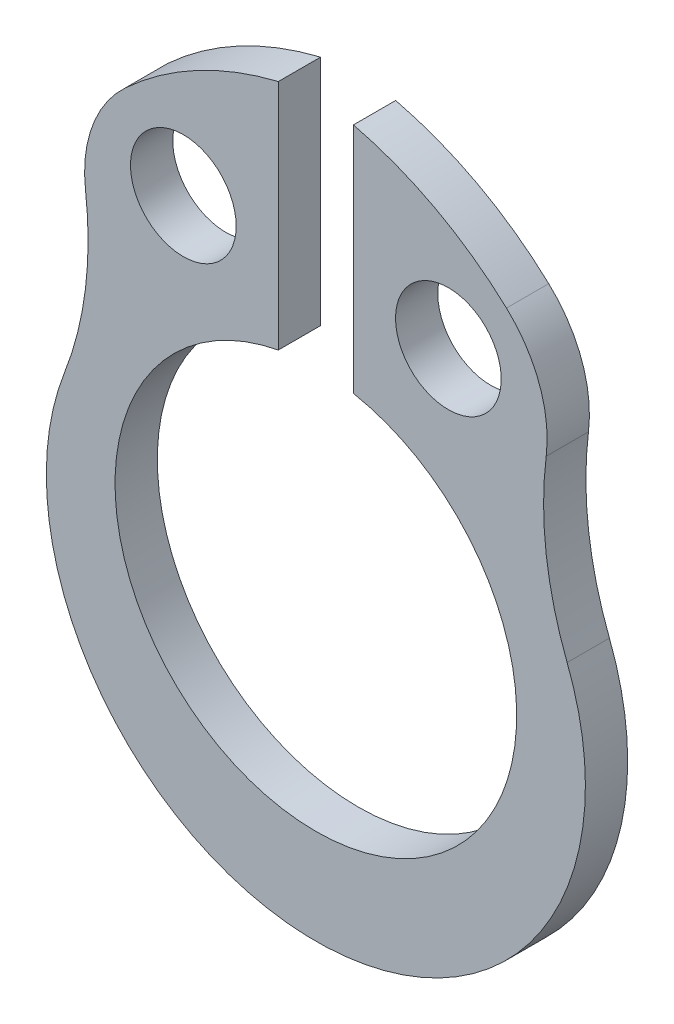
from build123d import *

# Parameters (mm, degrees)
SKETCH1_R           = 0.5
BOSS_EXTRUDE1_DEPTH = 0.2


with BuildPart() as part:
    # Sketch1 → Boss-Extrude1 (new, symmetric)
    with BuildSketch(Plane.XY):
        with BuildLine():
            Line((0.355177163, 4.066507215), (0.355177163, 1.866507215))
            ThreePointArc((0.355177163, 1.866507215), (0, -1.9), (-0.355177163, 1.866507215))
            Line((-0.355177163, 1.866507215), (-0.355177163, 4.066507215))
            ThreePointArc((-0.355177163, 4.066507215), (-1.128937663, 3.770726054), (-1.80338405, 3.289775039))
            ThreePointArc((-1.80338405, 3.289775039), (-2.114987451, 2.821889427), (-2.179084676, 2.263404717))
            ThreePointArc((-2.179084676, 2.263404717), (-2.179717367, 1.455750813), (-2.377239579, 0.67262234))
            ThreePointArc((-2.377239579, 0.67262234), (0, -2.8), (2.377239579, 0.67262234))
            ThreePointArc((2.377239579, 0.67262234), (2.179717367, 1.455750813), (2.179084676, 2.263404717))
            ThreePointArc((2.179084676, 2.263404717), (2.114987451, 2.821889427), (1.80338405, 3.289775039))
            ThreePointArc((1.80338405, 3.289775039), (1.128937663, 3.770726054), (0.355177163, 4.066507215))
        make_face()
        with Locations((-1.253673205, 2.682219999)):
            Circle(SKETCH1_R, mode=Mode.SUBTRACT)
        with Locations(Location((1.253673205, 2.682219999, 0), (0, 0, 180))):
            Circle(SKETCH1_R, mode=Mode.SUBTRACT)
    extrude(amount=BOSS_EXTRUDE1_DEPTH, both=True)


solid = part.part
